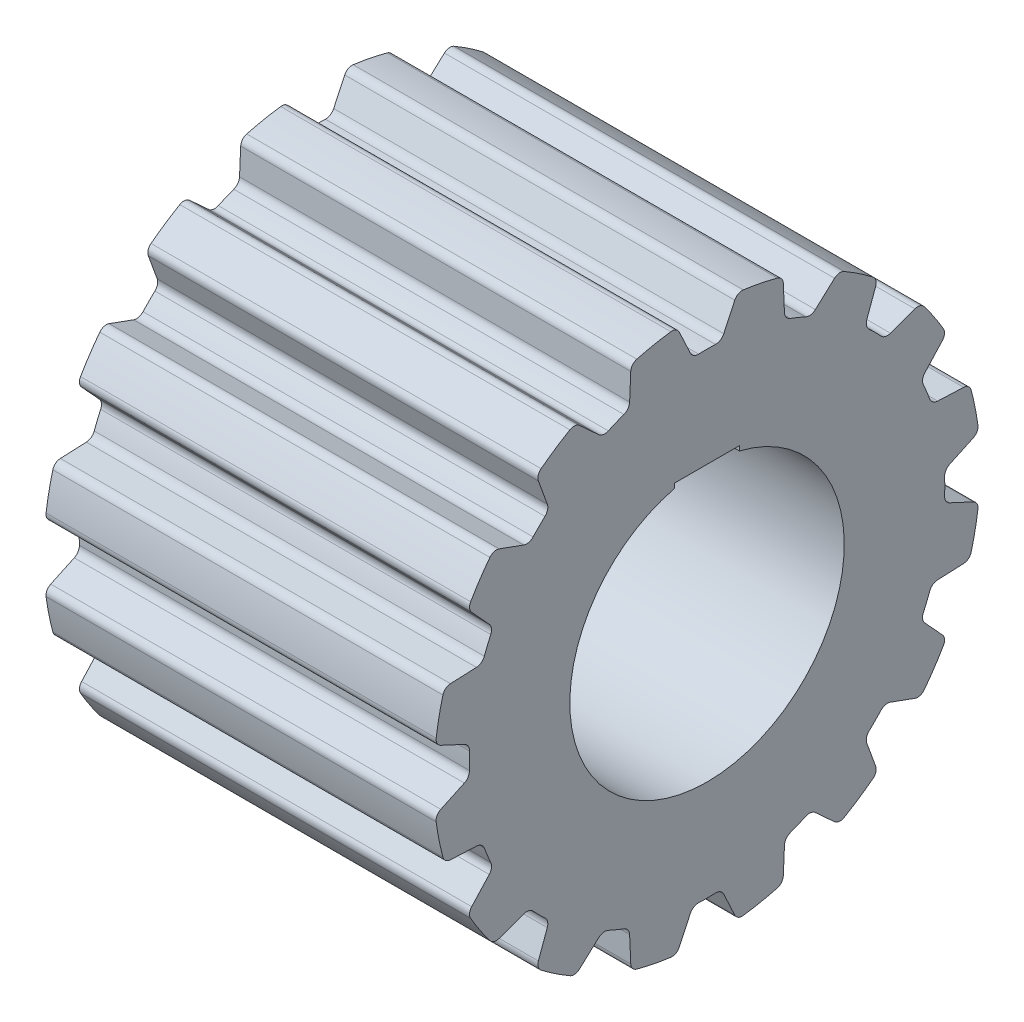
from build123d import *

# Parameters (mm, degrees)
CHAMFER_1_SIZE           = 1
SKETCH_4_W               = 3
SKETCH_4_H               = 1.630303969
CUT_EXTRUDE_1_DEPTH      = 43.109684421
CUT_EXTRUDE_2_REACH      = 44.11
PATTERN_CIRCULAR_3_COUNT = 16
SKETCH_7_R               = 23.358425388
CUT_EXTRUDE_3_DEPTH      = 20


with BuildPart() as part:
    # 草图1 → 旋转1 (revolve)
    with BuildSketch(Plane.XY):
        Polygon((0, 5), (0, 12.681), (38.1, 12.681), (38.1, 6.3664), (6.65, 6.3664), (6.65, 5), align=None)
    revolve(axis=Axis((0, 0, 0), (1, 0, 0)))

    # 倒角1
    chamfer_1_edges = [part.edges().sort_by_distance(p)[0] for p in [
        (6.65, -5, 0),
        (0, -5, 0),
    ]]
    chamfer(chamfer_1_edges, length=CHAMFER_1_SIZE)

    # 草图4 → 切除-拉伸1 (cut, through all)
    with BuildSketch(Plane.ZY):
        with Locations((0, 5.584847992)):
            Rectangle(SKETCH_4_W, SKETCH_4_H)
    extrude(amount=-CUT_EXTRUDE_1_DEPTH, mode=Mode.SUBTRACT)

    # 草图6 → 切除-拉伸2 (cut, up to next)
    with BuildSketch(Plane(origin=(0, 0, 0), x_dir=(0, 0, -1), z_dir=(1, 0, 0)), mode=Mode.PRIVATE) as cut_extrude_2_sk1:
        with BuildLine():
            Line((1.285723043, 12.353105336), (0.776264221, 11.260567368))
            ThreePointArc((0.776264221, 11.260567368), (0.618819992, 11.084207877), (0.390175975, 11.02409741))
            ThreePointArc((0.390175975, 11.02409741), (0, 11.031), (-0.390175975, 11.02409741))
            ThreePointArc((-0.390175975, 11.02409741), (-0.618819992, 11.084207877), (-0.776264221, 11.260567368))
            Line((-0.776264221, 11.260567368), (-1.285723043, 12.353105336))
            ThreePointArc((-1.285723043, 12.353105336), (-1.447679281, 12.525850138), (-1.680477339, 12.569158958))
            ThreePointArc((-1.680477339, 12.569158958), (-1.868612982, 12.542569375), (-2.056329114, 12.513163931))
            Line((-2.056329114, 12.513163931), (-2.671802841, 13.8330516))
            ThreePointArc((-2.671802841, 13.8330516), (0, 14.088713461), (2.671802841, 13.8330516))
            Line((2.671802841, 13.8330516), (2.056329114, 12.513163931))
            ThreePointArc((2.056329114, 12.513163931), (1.868612982, 12.542569375), (1.680477339, 12.569158958))
            ThreePointArc((1.680477339, 12.569158958), (1.447679281, 12.525850138), (1.285723043, 12.353105336))
        make_face()
    cut_extrude_2_tool1 = extrude(cut_extrude_2_sk1.sketch, amount=CUT_EXTRUDE_2_REACH, mode=Mode.PRIVATE) & part.part
    cut_extrude_2 = cut_extrude_2_tool1.solids().sort_by_distance((0, 12.873618, 0))[0]
    add(cut_extrude_2, mode=Mode.SUBTRACT)

    # 阵列(圆周)3: 切除-拉伸2 ×16 about axis
    pattern_circular_3_axis = Axis((-1.4, 0, 0), (1, 0, 0))
    for i in range(1, PATTERN_CIRCULAR_3_COUNT):
        add(cut_extrude_2.rotate(pattern_circular_3_axis, i * 360 / PATTERN_CIRCULAR_3_COUNT), mode=Mode.SUBTRACT)

    # 草图7 → 切除-拉伸3 (cut)
    with BuildSketch(Plane.ZY):
        Circle(SKETCH_7_R)
    extrude(amount=-CUT_EXTRUDE_3_DEPTH, mode=Mode.SUBTRACT)


solid = part.part
